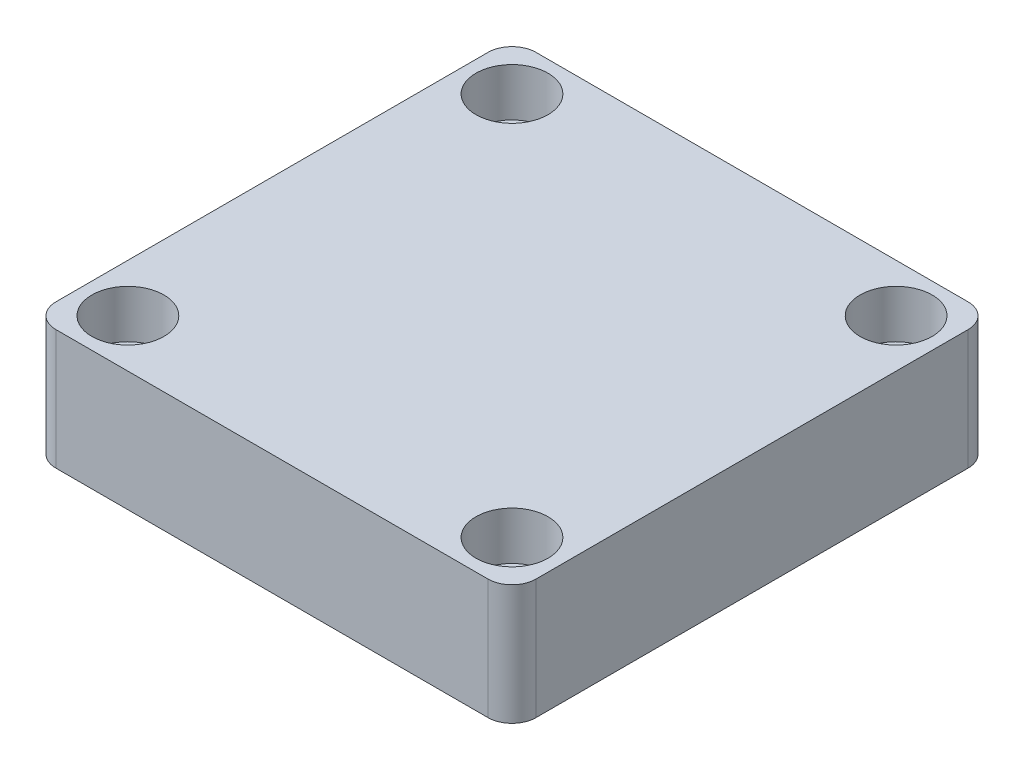
from build123d import *

# Parameters (mm, degrees)
SKETCH_1_W          = 40
SKETCH_1_H          = 40
SKETCH_1_R          = 1.5
EXTRUDE_1_DEPTH     = 10
FILLET_1_R          = 2
SKETCH_2_R          = 3
CUT_EXTRUDE_1_DEPTH = 4


with BuildPart() as part:
    # Эскиз1 → Бобышка-Вытянуть1 (new body)
    with BuildSketch(Plane(origin=(0, 0, 0), x_dir=(1, 0, 0), z_dir=(0, 1, 0))):
        with Locations((0.283687943, -8.156028369)):
            Rectangle(SKETCH_1_W, SKETCH_1_H)
        with Locations(Location((-15.716312057, 7.843971631, 0), (0, 0, 270))):
            Circle(SKETCH_1_R, mode=Mode.SUBTRACT)
        with Locations(Location((16.283687943, 7.843971631, 0), (0, 0, 270))):
            Circle(SKETCH_1_R, mode=Mode.SUBTRACT)
        with Locations(Location((16.283687943, -24.156028369, 0), (0, 0, 270))):
            Circle(SKETCH_1_R, mode=Mode.SUBTRACT)
        with Locations(Location((-15.716312057, -24.156028369, 0), (0, 0, 270))):
            Circle(SKETCH_1_R, mode=Mode.SUBTRACT)
    extrude(amount=EXTRUDE_1_DEPTH)

    # Скругление1
    fillet_1_edges = [part.edges().sort_by_distance(p)[0] for p in [
        (-19.716312057, 5, -11.843971631),
        (20.283687943, 5, -11.843971631),
        (20.283687943, 5, 28.156028369),
        (-19.716312057, 5, 28.156028369),
    ]]
    fillet(fillet_1_edges, radius=FILLET_1_R)

    # Эскиз2 → Вырез-Вытянуть1 (cut)
    with BuildSketch(Plane(origin=(0, 10, 0), x_dir=(1, 0, 0), z_dir=(0, 1, 0))):
        with Locations(Location((-15.716312057, 7.843971631, 0), (0, 0, 270))):
            Circle(SKETCH_2_R)
        with Locations(Location((16.283687943, 7.843971631, 0), (0, 0, 270))):
            Circle(SKETCH_2_R)
        with Locations(Location((16.283687943, -24.156028369, 0), (0, 0, 270))):
            Circle(SKETCH_2_R)
        with Locations(Location((-15.716312057, -24.156028369, 0), (0, 0, 270))):
            Circle(SKETCH_2_R)
    extrude(amount=-CUT_EXTRUDE_1_DEPTH, mode=Mode.SUBTRACT)


solid = part.part
